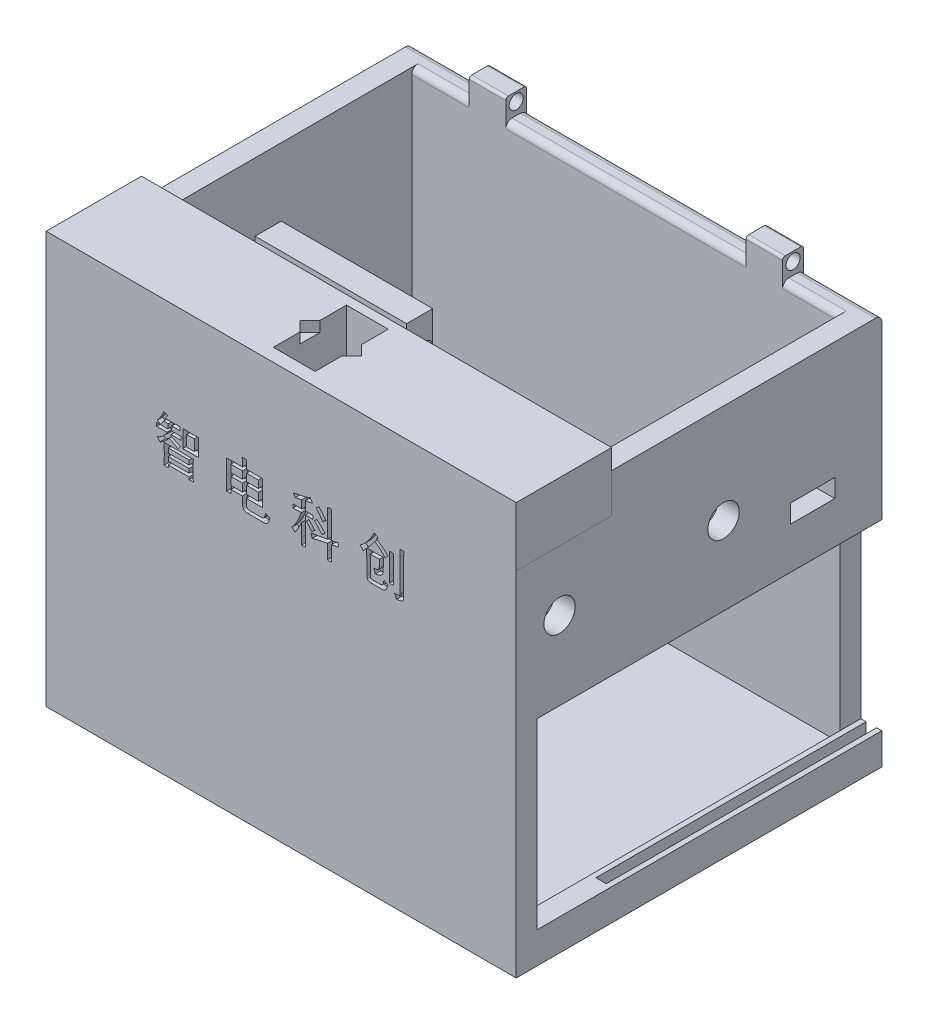
from build123d import *

# Parameters (mm, degrees)
SKETCH_1_W             = 90
SKETCH_1_H             = 70
EXTRUDE_1_DEPTH        = 75
SHELL_1_T              = -4
SKETCH_2_W             = 7
SKETCH_2_H             = 4
EXTRUDE_2_DEPTH        = 4
FILLET_3_R             = 0.5
SKETCH_4_R             = 1.35
CUT_EXTRUDE_1_DEPTH    = 126.558751188
FILLET_3_OF_MIRROR_2_R = 0.5
EXTRUDE_START          = -90
SKETCH_6_W             = 18.256446172
SKETCH_6_H             = 3.830399347
SKETCH_6_H_2           = 7.485933585
EXTRUDE_3_DEPTH        = 90.000012
SKETCH_7_W             = 66
SKETCH_7_H             = 35
CUT_EXTRUDE_2_DEPTH    = 4
SKETCH_8_W             = 8
SKETCH_8_H             = 14
CUT_EXTRUDE_3_DEPTH    = 17
SKETCH_10_W            = 5
SKETCH_10_H            = 12
EXTRUDE_4_DEPTH        = 29
SKETCH_13_R            = 1.25
CUT_EXTRUDE_5_DEPTH    = 10
SKETCH_14_W            = 30
SKETCH_14_H            = 4
EXTRUDE_5_DEPTH        = 25
CUT_EXTRUDE_6_DEPTH    = 2
FILLET_4_R             = 1.2
SKETCH_16_R            = 3
CUT_EXTRUDE_8_DEPTH    = 10
SKETCH_17_W            = 2
SKETCH_17_H            = 51.743553828
CUT_EXTRUDE_9_DEPTH    = 2
CUT_EXTRUDE_10_REACH   = 140.712
SKETCH_18_W            = 8.5
SKETCH_18_H            = 3.5
SKETCH_22_W            = 3.991228071
SKETCH_22_H            = 0.83625731
SKETCH_22_H_2          = 0.798245614
SKETCH_22_W_2          = 1.444444444
SKETCH_22_H_3          = 2.090643275
SKETCH_22_W_3          = 2.280701755
SKETCH_22_H_4          = 1.520467836
SKETCH_22_W_4          = 2.204678363
SKETCH_22_H_5          = 1.406432748
CUT_EXTRUDE_13_DEPTH   = 1


with BuildPart() as part:
    # 草图1 → 凸台-拉伸1 (new body)
    with BuildSketch(Plane(origin=(0, 0, 0), x_dir=(1, 0, 0), z_dir=(0, 1, 0))):
        with Locations((45, 35)):
            Rectangle(SKETCH_1_W, SKETCH_1_H)
    extrude(amount=EXTRUDE_1_DEPTH)

    # 抽壳1
    shell_1_openings = [part.faces().sort_by_distance(p)[0] for p in [
        (45, 75, -35),
    ]]
    offset(amount=SHELL_1_T, openings=shell_1_openings, kind=Kind.INTERSECTION)

    # 草图2 → 凸台-拉伸2 (add)
    with BuildSketch(Plane(origin=(0, 75, 0), x_dir=(1, 0, 0), z_dir=(0, 1, 0))):
        with Locations((18.5, 68)):
            Rectangle(SKETCH_2_W, SKETCH_2_H)
    extrude_2 = extrude(amount=EXTRUDE_2_DEPTH)

    # 圆角3
    fillet_3_edges = [part.edges().sort_by_distance(p)[0] for p in [
        (18.5, 79, -70),
        (18.5, 79, -66),
    ]]
    fillet(fillet_3_edges, radius=FILLET_3_R)

    # 草图4 → 切除-拉伸1 (cut, through all)
    with BuildSketch(Plane(origin=(22, 0, 0), x_dir=(0, 0, -1), z_dir=(1, 0, 0))):
        with Locations((68, 77.3)):
            Circle(SKETCH_4_R)
    cut_extrude_1 = extrude(amount=-CUT_EXTRUDE_1_DEPTH, mode=Mode.SUBTRACT)

    # 镜向2: 凸台-拉伸2, 切除-拉伸1 across plane
    add(extrude_2.mirror(Plane.ZY.offset(-45)))
    add(cut_extrude_1.mirror(Plane.ZY.offset(-45)), mode=Mode.SUBTRACT)

    # 圆角3 of 镜向2
    fillet_3_of_mirror_2_edges = [part.edges().sort_by_distance(p)[0] for p in [
        (71.5, 79, -70),
        (71.5, 79, -66),
    ]]
    fillet(fillet_3_of_mirror_2_edges, radius=FILLET_3_OF_MIRROR_2_R)

    # 草图6 → 凸台-拉伸3 (add)
    with BuildSketch(Plane(origin=(90, 0, 0), x_dir=(0, 0, -1), z_dir=(1, 0, 0)).offset(EXTRUDE_START)):
        with Locations((9.128223086, 76.915199674)):
            Rectangle(SKETCH_6_W, SKETCH_6_H)
        with Locations((9.128223086, 71.257033208)):
            Rectangle(SKETCH_6_W, SKETCH_6_H_2)
    extrude(amount=EXTRUDE_3_DEPTH)

    # 草图7 → 切除-拉伸2 (cut)
    with BuildSketch(Plane(origin=(90, 0, 0), x_dir=(0, 0, -1), z_dir=(1, 0, 0))):
        with Locations((37, 23.5)):
            Rectangle(SKETCH_7_W, SKETCH_7_H)
    extrude(amount=-CUT_EXTRUDE_2_DEPTH, mode=Mode.SUBTRACT)

    # 草图8 → 切除-拉伸3 (cut)
    with BuildSketch(Plane(origin=(0, 78.830399347, 0), x_dir=(1, 0, 0), z_dir=(0, 1, 0))):
        with Locations((45, 9.5)):
            Rectangle(SKETCH_8_W, SKETCH_8_H)
    extrude(amount=-CUT_EXTRUDE_3_DEPTH, mode=Mode.SUBTRACT)

    # 草图10 → 凸台-拉伸4 (add)
    with BuildSketch(Plane(origin=(4, 0, 0), x_dir=(0, 0, -1), z_dir=(1, 0, 0))):
        with Locations((38.5, 56)):
            Rectangle(SKETCH_10_W, SKETCH_10_H)
        with Locations((9.5, 56)):
            Rectangle(SKETCH_10_W, SKETCH_10_H)
    extrude(amount=EXTRUDE_4_DEPTH)

    # 草图13 → 切除-拉伸5 (cut)
    with BuildSketch(Plane(origin=(33, 0, 0), x_dir=(0, 0, -1), z_dir=(1, 0, 0))):
        with Locations((39.7, 56)):
            Circle(SKETCH_13_R)
        with Locations(Location((8.3, 56, 0), (0, 0, 180))):
            Circle(SKETCH_13_R)
    extrude(amount=-CUT_EXTRUDE_5_DEPTH, mode=Mode.SUBTRACT)

    # 草图14 → 凸台-拉伸5 (add)
    with BuildSketch(Plane(origin=(0, 0, -4), x_dir=(-1, 0, 0), z_dir=(0, 0, -1))):
        with Locations((-72, 44)):
            Rectangle(SKETCH_14_W, SKETCH_14_H)
    extrude(amount=EXTRUDE_5_DEPTH)

    # 草图15 → 切除-拉伸6 (cut)
    with BuildSketch(Plane(origin=(0, 78.830399347, 0), x_dir=(1, 0, 0), z_dir=(0, 1, 0))):
        Polygon((49, 11.413009546), (50.913009546, 9.5), (49, 7.586990454), align=None)
        Polygon((41, 7.586990454), (41, 11.413009546), (39.086990454, 9.5), align=None)
    extrude(amount=-CUT_EXTRUDE_6_DEPTH, mode=Mode.SUBTRACT)

    # 圆角4
    fillet_4_edges = [part.edges().sort_by_distance(p)[0] for p in [
        (9.5, 75, -66),
        (45, 75, -70),
        (45, 75, -66),
        (7.5, 75, -70),
        (80.5, 75, -66),
        (82.5, 75, -70),
    ]]
    fillet(fillet_4_edges, radius=FILLET_4_R)

    # 草图16 → 切除-拉伸8 (cut)
    with BuildSketch(Plane(origin=(90, 0, 0), x_dir=(0, 0, -1), z_dir=(1, 0, 0))):
        with Locations((8.3, 56)):
            Circle(SKETCH_16_R)
        with Locations((39.7, 56)):
            Circle(SKETCH_16_R)
    extrude(amount=-CUT_EXTRUDE_8_DEPTH, mode=Mode.SUBTRACT)

    # 草图17 → 切除-拉伸9 (cut)
    with BuildSketch(Plane(origin=(0, 6, 0), x_dir=(1, 0, 0), z_dir=(0, 1, 0))):
        with Locations((88, 44.128223086)):
            Rectangle(SKETCH_17_W, SKETCH_17_H)
    cut_extrude_9 = extrude(amount=-CUT_EXTRUDE_9_DEPTH, mode=Mode.SUBTRACT)

    # 镜向3: 切除-拉伸9 across plane
    add(cut_extrude_9.mirror(Plane.ZX.offset(23.5)), mode=Mode.SUBTRACT)

    # 草图18 → 切除-拉伸10 (cut, up to next)
    with BuildSketch(Plane(origin=(90, 0, 0), x_dir=(0, 0, -1), z_dir=(1, 0, 0)), mode=Mode.PRIVATE) as cut_extrude_10_sk1:
        with Locations((56.75, 50.75)):
            Rectangle(SKETCH_18_W, SKETCH_18_H)
    cut_extrude_10_tool1 = extrude(cut_extrude_10_sk1.sketch, amount=-CUT_EXTRUDE_10_REACH, mode=Mode.PRIVATE) & part.part
    add(cut_extrude_10_tool1.solids().sort_by_distance((90, 50.75, -56.75))[0], mode=Mode.SUBTRACT)

    # 草图22 → 切除-拉伸13 (cut)
    # profile 1 of 12: a face of its own
    with BuildSketch(Plane.XY):
        with BuildLine():
            add(Edge.make_bspline(
                [(28.165960381, 55.10846109), (28.163134734, 55.051679378), (28.157157268, 54.931561451), (28.147914895, 54.741557576), (28.143531593, 54.532180049), (28.137229462, 54.30413861), (28.133150208, 54.057284017), (28.130919089, 53.791191064), (28.127126936, 53.505877917), (28.127669165, 53.309242203), (28.127948685, 53.207876295)],
                knots=[0, 0, 0, 0, 0.717688836, 1.518222909, 2.401221988, 3.361207998, 4.398066271, 5.517771386, 6.720408654, 8, 8, 8, 8], degree=3))
            add(Edge.make_bspline(
                [(28.127948685, 53.207876295), (28.127667125, 53.106510371), (28.127122241, 52.91034389), (28.130924805, 52.625500129), (28.133162774, 52.359407363), (28.137214343, 52.112083004), (28.143506584, 51.884041171), (28.147940353, 51.675134172), (28.157199059, 51.48513179), (28.163139891, 51.364542753), (28.165960381, 51.3072915)],
                knots=[0, 0, 0, 0, 1.279592248, 2.476306615, 3.596012518, 4.638794695, 5.598781382, 6.475859193, 7.276393831, 8, 8, 8, 8], degree=3))
            Line((28.165960381, 51.3072915), (27.367714767, 51.3072915))
            Line((27.367714767, 51.3072915), (27.367714767, 51.76343185))
            Line((27.367714767, 51.76343185), (23.376486696, 51.76343185))
            Line((23.376486696, 51.76343185), (23.376486696, 51.3072915))
            Line((23.376486696, 51.3072915), (22.578241082, 51.3072915))
            add(Edge.make_bspline(
                [(22.578241082, 51.3072915), (22.581075708, 51.361257031), (22.587113746, 51.476209067), (22.596288468, 51.658706116), (22.600698109, 51.861515795), (22.606992837, 52.083925448), (22.611060583, 52.326557302), (22.61328319, 52.589365499), (22.617084046, 52.872801405), (22.616536429, 53.068498657), (22.616252778, 53.169864599)],
                knots=[0, 0, 0, 0, 0.696099489, 1.482762265, 2.353551712, 3.30893886, 4.348805569, 5.479251049, 6.694319468, 8, 8, 8, 8], degree=3))
            add(Edge.make_bspline(
                [(22.616252778, 53.169864599), (22.616533713, 53.274046162), (22.617077877, 53.475843791), (22.613278778, 53.768665605), (22.611056161, 54.041328251), (22.606985176, 54.293814302), (22.600679603, 54.526079609), (22.596311781, 54.73827281), (22.587038805, 54.930153232), (22.581065852, 55.051210055), (22.578241082, 55.10846109)],
                knots=[0, 0, 0, 0, 1.289361226, 2.497467228, 3.624266192, 4.664032279, 5.622622853, 6.499928456, 7.290575728, 8, 8, 8, 8], degree=3))
            Line((22.578241082, 55.10846109), (28.165960381, 55.10846109))
        make_face()
        with Locations((25.372100732, 54.158168693)):
            Rectangle(SKETCH_22_W, SKETCH_22_H, mode=Mode.SUBTRACT)
        with Locations((25.372100732, 52.770741792)):
            Rectangle(SKETCH_22_W, SKETCH_22_H_2, mode=Mode.SUBTRACT)
    # profile 2 of 12: a face of its own
    with BuildSketch(Plane.XY):
        with BuildLine():
            add(Edge.make_bspline(
                [(23.300463305, 59.897934774), (23.254831976, 59.850118115), (23.158577232, 59.749253635), (23.019231767, 59.579540428), (22.8730454, 59.387713941), (22.779302801, 59.248501945), (22.730287866, 59.175712552)],
                knots=[0, 0, 0, 0, 0.860429603, 1.814990543, 2.857530113, 4, 4, 4, 4], degree=3))
            add(Edge.make_bspline(
                [(22.730287866, 59.175712552), (22.895006108, 59.175423852), (23.210836306, 59.174870299), (23.665093933, 59.178653985), (24.07994451, 59.180892716), (24.455848741, 59.184888755), (24.792771826, 59.191218506), (25.090354894, 59.195518529), (25.348895226, 59.204660172), (25.507959406, 59.210867478), (25.581165059, 59.213724248)],
                knots=[0, 0, 0, 0, 1.386451186, 2.658376808, 3.823654584, 4.878372057, 5.822555073, 6.660104833, 7.383343872, 8, 8, 8, 8], degree=3))
            Line((25.581165059, 59.213724248), (25.581165059, 58.529513722))
            add(Edge.make_bspline(
                [(25.581165059, 58.529513722), (25.445088141, 58.53553894), (25.179091288, 58.547316757), (24.78952941, 58.557947074), (24.418787126, 58.56552429), (24.178020798, 58.566869774), (24.060697223, 58.567525418)],
                knots=[0, 0, 0, 0, 1.074576133, 2.100531618, 3.074403708, 4, 4, 4, 4], degree=3))
            add(Edge.make_bspline(
                [(24.060697223, 58.567525418), (24.060001671, 58.506513453), (24.05851925, 58.376479308), (24.050901939, 58.169982457), (24.040009861, 57.93949386), (24.028660133, 57.778175791), (24.022685527, 57.693256412)],
                knots=[0, 0, 0, 0, 0.8365234, 1.782873351, 2.832883257, 4, 4, 4, 4], degree=3))
            add(Edge.make_bspline(
                [(24.022685527, 57.693256412), (24.12076656, 57.692972033), (24.309894154, 57.692423671), (24.583474917, 57.696219466), (24.836897735, 57.698455523), (25.070614126, 57.702509044), (25.284106895, 57.708778727), (25.477535013, 57.713206961), (25.650176037, 57.722356298), (25.758555027, 57.728428584), (25.809235234, 57.731268108)],
                knots=[0, 0, 0, 0, 1.317082673, 2.539702846, 3.674102439, 4.720377199, 5.678587124, 6.542305879, 7.318352759, 8, 8, 8, 8], degree=3))
            Line((25.809235234, 57.731268108), (25.809235234, 57.047057581))
            add(Edge.make_bspline(
                [(25.809235234, 57.047057581), (25.757616581, 57.049899318), (25.646891967, 57.055994987), (25.468619947, 57.065227737), (25.266742763, 57.069525193), (25.041049261, 57.075865065), (24.791846038, 57.079879224), (24.518714486, 57.08212206), (24.221668724, 57.085903464), (24.015647673, 57.085354423), (23.908650439, 57.085069277)],
                knots=[0, 0, 0, 0, 0.652599893, 1.399859659, 2.253233241, 3.201356656, 4.250041164, 5.399342793, 6.649346148, 8, 8, 8, 8], degree=3))
            Line((23.908650439, 57.085069277), (23.832627047, 56.818987406))
            add(Edge.make_bspline(
                [(23.832627047, 56.818987406), (23.92838608, 56.781512634), (24.114951841, 56.708501146), (24.386707361, 56.600859114), (24.641899627, 56.494331147), (24.882354749, 56.39339585), (25.107943781, 56.296512568), (25.317786792, 56.202273307), (25.511911123, 56.110824908), (25.635678398, 56.049995615), (25.695200147, 56.020741792)],
                knots=[0, 0, 0, 0, 1.217478731, 2.371993931, 3.460560076, 4.491433558, 5.459547401, 6.367248122, 7.214782365, 8, 8, 8, 8], degree=3))
            add(Edge.make_bspline(
                [(25.695200147, 56.020741792), (25.647624214, 55.954231384), (25.557638958, 55.828433408), (25.433029828, 55.648505368), (25.328683326, 55.486752816), (25.267430695, 55.384084853), (25.239059796, 55.336531266)],
                knots=[0, 0, 0, 0, 1.192855985, 2.256171212, 3.192296089, 4, 4, 4, 4], degree=3))
            add(Edge.make_bspline(
                [(25.239059796, 55.336531266), (25.100183183, 55.434037609), (24.82717956, 55.625715563), (24.399095226, 55.870558986), (23.970161328, 56.084865452), (23.674627006, 56.194577334), (23.52853348, 56.248811967)],
                knots=[0, 0, 0, 0, 1.046220223, 2.056659537, 3.039335061, 4, 4, 4, 4], degree=3))
            add(Edge.make_bspline(
                [(23.52853348, 56.248811967), (23.473522814, 56.179590809), (23.362697174, 56.040136411), (23.179950022, 55.842466874), (22.98609026, 55.650545512), (22.777695653, 55.467106061), (22.55692012, 55.289987015), (22.323273273, 55.11947333), (22.076042438, 54.957355506), (21.904756938, 54.855801083), (21.818007164, 54.804367523)],
                knots=[0, 0, 0, 0, 0.941490525, 1.896746551, 2.865224293, 3.846121799, 4.852367462, 5.879161404, 6.925873659, 8, 8, 8, 8], degree=3))
            add(Edge.make_bspline(
                [(21.818007164, 54.804367523), (21.778351181, 54.854705796), (21.697789331, 54.956968911), (21.561394985, 55.101992295), (21.411370497, 55.242625193), (21.302846114, 55.330165868), (21.247831726, 55.374542962)],
                knots=[0, 0, 0, 0, 0.950670924, 1.931305206, 2.951314193, 4, 4, 4, 4], degree=3))
            add(Edge.make_bspline(
                [(21.247831726, 55.374542962), (21.354358107, 55.42193061), (21.568326191, 55.517113083), (21.873945796, 55.695133102), (22.168209404, 55.899997082), (22.399588085, 56.092589083), (22.575897781, 56.25342466), (22.693314819, 56.376963591), (22.801783686, 56.496093268), (22.895831183, 56.61590888), (22.978144202, 56.734121384), (23.047360874, 56.851934625), (23.106113563, 56.967495403), (23.134625338, 57.04673903), (23.148416521, 57.085069277)],
                knots=[0, 0, 0, 0, 1.601391474, 3.216542815, 4.851849856, 6.524081266, 7.350155524, 8.130127338, 8.865520099, 9.563565357, 10.221927471, 10.843567295, 11.440631977, 12, 12, 12, 12], degree=3))
            add(Edge.make_bspline(
                [(23.148416521, 57.085069277), (23.035318709, 57.085355094), (22.817566016, 57.08590539), (22.503156576, 57.08211027), (22.214069729, 57.079894246), (21.949851048, 57.075845262), (21.710546239, 57.069527518), (21.496003821, 57.065223737), (21.306465744, 57.055994708), (21.188700384, 57.049899327), (21.133796638, 57.047057581)],
                knots=[0, 0, 0, 0, 1.346904771, 2.593260969, 3.744611422, 4.789854585, 5.740216353, 6.59559745, 7.345249219, 8, 8, 8, 8], degree=3))
            Line((21.133796638, 57.047057581), (21.133796638, 57.731268108))
            add(Edge.make_bspline(
                [(21.133796638, 57.731268108), (21.189638408, 57.728414057), (21.310685028, 57.722227411), (21.507268614, 57.71306125), (21.733539883, 57.708754158), (21.9897407, 57.70243871), (22.275546414, 57.698438235), (22.590911732, 57.696194397), (22.935825357, 57.692418385), (23.175633607, 57.692969523), (23.300463305, 57.693256412)],
                knots=[0, 0, 0, 0, 0.619202912, 1.342228594, 2.179169066, 3.125212228, 4.180274652, 5.344400755, 6.617655352, 8, 8, 8, 8], degree=3))
            add(Edge.make_bspline(
                [(23.300463305, 57.693256412), (23.311672493, 57.772931238), (23.333438852, 57.927646359), (23.350490961, 58.15377001), (23.352597102, 58.365950917), (23.343075472, 58.501859711), (23.338475, 58.567525418)],
                knots=[0, 0, 0, 0, 1.100425231, 2.136840844, 3.099795842, 4, 4, 4, 4], degree=3))
            Line((23.338475, 58.567525418), (22.464205995, 58.567525418))
            add(Edge.make_bspline(
                [(22.464205995, 58.567525418), (22.425495043, 58.498120602), (22.348029276, 58.359232324), (22.218683914, 58.157891815), (22.081186365, 57.960168691), (21.981922406, 57.833121191), (21.932042252, 57.769279804)],
                knots=[0, 0, 0, 0, 0.992557335, 1.986239381, 2.988084993, 4, 4, 4, 4], degree=3))
            add(Edge.make_bspline(
                [(21.932042252, 57.769279804), (21.866204133, 57.805639739), (21.742021633, 57.874221099), (21.568712733, 57.974766611), (21.418080739, 58.063433859), (21.327431507, 58.122361788), (21.285843422, 58.149396763)],
                knots=[0, 0, 0, 0, 1.203506377, 2.270028857, 3.206323262, 4, 4, 4, 4], degree=3))
            add(Edge.make_bspline(
                [(21.285843422, 58.149396763), (21.339078108, 58.21220881), (21.453677692, 58.347425806), (21.622645241, 58.576656754), (21.804187483, 58.843027597), (21.95791039, 59.087686668), (22.083121884, 59.291666907), (22.16870957, 59.442803518), (22.24699082, 59.586495321), (22.314683019, 59.723746628), (22.377055542, 59.852307141), (22.426912698, 59.974992818), (22.47040246, 60.09000854), (22.49190993, 60.165735243), (22.502217691, 60.202028342)],
                knots=[0, 0, 0, 0, 1.235038088, 2.658696051, 4.269830463, 6.070755045, 6.993291449, 7.860485822, 8.676401911, 9.44784651, 10.156490949, 10.819413862, 11.434187314, 12, 12, 12, 12], degree=3))
            add(Edge.make_bspline(
                [(22.502217691, 60.202028342), (22.556379243, 60.176063779), (22.67169443, 60.120782714), (22.860419754, 60.046590537), (23.071972152, 59.969966225), (23.221898884, 59.922702075), (23.300463305, 59.897934774)],
                knots=[0, 0, 0, 0, 0.842680993, 1.79414938, 2.844092885, 4, 4, 4, 4], degree=3))
        make_face()
    # profile 3 of 12: a face of its own
    with BuildSketch(Plane.XY):
        with BuildLine():
            add(Edge.make_bspline(
                [(26.151340498, 55.868695008), (26.154144021, 55.921723551), (26.159973751, 56.031992713), (26.169296087, 56.203681982), (26.173731988, 56.38819461), (26.180047382, 56.585728294), (26.184121888, 56.796449864), (26.186356945, 57.020309532), (26.190171331, 57.257284601), (26.189630444, 57.419664385), (26.189352193, 57.503197932)],
                knots=[0, 0, 0, 0, 0.779414185, 1.620737502, 2.523455647, 3.488136681, 4.521508502, 5.616750258, 6.773977286, 8, 8, 8, 8], degree=3))
            add(Edge.make_bspline(
                [(26.189352193, 57.503197932), (26.189628874, 57.589547086), (26.190167215, 57.757557899), (26.186377494, 58.002042148), (26.184112152, 58.232470935), (26.18006898, 58.448355064), (26.173714494, 58.65058107), (26.169354685, 58.838380284), (26.160013545, 59.011947647), (26.154148893, 59.122684287), (26.151340498, 59.175712552)],
                knots=[0, 0, 0, 0, 1.238563026, 2.409890213, 3.507178093, 4.543998171, 5.506953548, 6.409352315, 7.238289259, 8, 8, 8, 8], degree=3))
            Line((26.151340498, 59.175712552), (29.154264474, 59.175712552))
            add(Edge.make_bspline(
                [(29.154264474, 59.175712552), (29.151416468, 59.13394969), (29.145274344, 59.043882236), (29.136060895, 58.898000087), (29.131764037, 58.730830243), (29.125420605, 58.541746578), (29.121456713, 58.331489268), (29.119180015, 58.099653093), (29.115418836, 57.846720842), (29.115967488, 57.670732533), (29.116252778, 57.579221324)],
                knots=[0, 0, 0, 0, 0.628982284, 1.356488263, 2.196056314, 3.141339513, 4.199232735, 5.355717388, 6.625013781, 8, 8, 8, 8], degree=3))
            add(Edge.make_bspline(
                [(29.116252778, 57.579221324), (29.115973004, 57.487240879), (29.115430568, 57.308906344), (29.119218938, 57.050343036), (29.12145601, 56.809590226), (29.125504952, 56.58713579), (29.131833589, 56.382562409), (29.136198541, 56.195699776), (29.145484328, 56.026353028), (29.15144199, 55.919376092), (29.154264474, 55.868695008)],
                knots=[0, 0, 0, 0, 1.290022382, 2.501135341, 3.626691029, 4.666794469, 5.621510824, 6.49727896, 7.288075228, 8, 8, 8, 8], degree=3))
            Line((29.154264474, 55.868695008), (26.151340498, 55.868695008))
        make_face()
        with Locations((27.633796638, 57.522203781)):
            Rectangle(SKETCH_22_W_2, SKETCH_22_H_3, mode=Mode.SUBTRACT)
    # profile 4 of 12: a face of its own
    with BuildSketch(Plane.XY):
        with BuildLine():
            add(Edge.make_bspline(
                [(42.861282018, 52.713724248), (42.839492579, 52.644187031), (42.7976904, 52.510782621), (42.733692675, 52.321309643), (42.669634672, 52.151639065), (42.609394847, 52.000829951), (42.546148277, 51.871265587), (42.48850167, 51.758926921), (42.429344753, 51.667216428), (42.370639796, 51.591815285), (42.305638323, 51.532306362), (42.234615782, 51.480271583), (42.152491834, 51.438840455), (42.061229048, 51.40493937), (41.961181622, 51.378718118), (41.851615685, 51.358553633), (41.732400748, 51.34799421), (41.649618373, 51.346219228), (41.606896053, 51.345303195)],
                knots=[0, 0, 0, 0, 1.702174165, 3.265554056, 4.67040763, 5.938607077, 7.056486703, 8.037238336, 8.885550175, 9.602851616, 10.262105392, 10.937474938, 11.653267151, 12.40252239, 13.20818955, 14.06607918, 15.001942329, 16, 16, 16, 16], degree=3))
            Line((41.606896053, 51.345303195), (38.641983772, 51.345303195))
            add(Edge.make_bspline(
                [(38.641983772, 51.345303195), (38.60068797, 51.34485065), (38.520372107, 51.343970498), (38.403008339, 51.350187846), (38.293339271, 51.367412887), (38.191016234, 51.391866716), (38.097698772, 51.428062059), (38.011101159, 51.470201352), (37.931214342, 51.52006869), (37.862597893, 51.582768586), (37.797603077, 51.649719927), (37.743324909, 51.728450628), (37.6949533, 51.814389687), (37.655591834, 51.909450867), (37.625008124, 52.012947522), (37.601193342, 52.124970343), (37.583997152, 52.245378547), (37.579804172, 52.328856685), (37.577656287, 52.371618985)],
                knots=[0, 0, 0, 0, 1.168119821, 2.271866497, 3.319426777, 4.304575247, 5.241409998, 6.143755183, 7.027454658, 7.892819379, 8.76618987, 9.661182454, 10.588185367, 11.552088977, 12.564145767, 13.636803855, 14.789435116, 16, 16, 16, 16], degree=3))
            Line((37.577656287, 52.371618985), (37.577656287, 53.702028342))
            Line((37.577656287, 53.702028342), (35.372977924, 53.702028342))
            Line((35.372977924, 53.702028342), (35.372977924, 52.979806119))
            Line((35.372977924, 52.979806119), (34.498708919, 52.979806119))
            add(Edge.make_bspline(
                [(34.498708919, 52.979806119), (34.500173737, 52.998103957), (34.503476984, 53.039366588), (34.507568705, 53.10883679), (34.511624061, 53.192846755), (34.516238708, 53.291371082), (34.518458891, 53.404505373), (34.521396969, 53.531675583), (34.524227081, 53.673868555), (34.526878517, 53.830141059), (34.530183544, 54.001417449), (34.531014122, 54.18726527), (34.532571481, 54.38764597), (34.533967275, 54.602576792), (34.535262747, 54.831585751), (34.5371467, 55.075608913), (34.536604436, 55.334185194), (34.536681211, 55.51157289), (34.536720614, 55.602613137)],
                knots=[0, 0, 0, 0, 0.335849478, 0.75735909, 1.273172232, 1.874755125, 2.561862521, 3.343391738, 4.202179413, 5.163982611, 6.203049845, 7.336455448, 8.564306306, 9.869430823, 11.269001192, 12.754431635, 14.334285019, 16, 16, 16, 16], degree=3))
            add(Edge.make_bspline(
                [(34.536720614, 55.602613137), (34.536682164, 55.694122668), (34.536607037, 55.872918215), (34.537141948, 56.134779375), (34.535251853, 56.384433905), (34.533950829, 56.622359147), (34.532575542, 56.848083472), (34.531001537, 57.061604138), (34.530157707, 57.26246751), (34.526859523, 57.451577501), (34.524165225, 57.62849738), (34.521383372, 57.793216139), (34.518392459, 57.945727652), (34.516172812, 58.086071263), (34.511520749, 58.214163187), (34.507372454, 58.330077561), (34.503238001, 58.433793958), (34.500152136, 58.499012091), (34.498708919, 58.529513722)],
                knots=[0, 0, 0, 0, 1.500478727, 2.931704589, 4.293699324, 5.594136985, 6.833017677, 7.994952324, 9.095330294, 10.126543337, 11.096205569, 11.996624329, 12.827801185, 13.597431334, 14.298035147, 14.929427821, 15.499307993, 16, 16, 16, 16], degree=3))
            Line((34.498708919, 58.529513722), (37.577656287, 58.529513722))
            add(Edge.make_bspline(
                [(37.577656287, 58.529513722), (37.577934572, 58.612577999), (37.578475437, 58.774019276), (37.574670163, 59.009117247), (37.572440764, 59.230161595), (37.568347941, 59.43712897), (37.5620952, 59.629501634), (37.557589382, 59.807914718), (37.548395787, 59.971630598), (37.542464412, 60.076262254), (37.539644591, 60.12600495)],
                knots=[0, 0, 0, 0, 1.248126266, 2.425821371, 3.533006246, 4.56980153, 5.536277045, 6.425221315, 7.251338075, 8, 8, 8, 8], degree=3))
            Line((37.539644591, 60.12600495), (38.375901901, 60.12600495))
            add(Edge.make_bspline(
                [(38.375901901, 60.12600495), (38.373057589, 60.081895278), (38.36694695, 59.987131344), (38.357785861, 59.835145061), (38.353433139, 59.663758877), (38.347126559, 59.473735114), (38.343076091, 59.264888279), (38.340841516, 59.036805273), (38.337061257, 58.789505002), (38.337607411, 58.618209289), (38.337890205, 58.529513722)],
                knots=[0, 0, 0, 0, 0.664174484, 1.426893108, 2.28761838, 3.239966529, 4.283778659, 5.42618217, 6.667297463, 8, 8, 8, 8], degree=3))
            Line((38.337890205, 58.529513722), (41.416837574, 58.529513722))
            add(Edge.make_bspline(
                [(41.416837574, 58.529513722), (41.413955492, 58.475550464), (41.407541332, 58.355453633), (41.398533783, 58.156042043), (41.394265349, 57.918508929), (41.387947701, 57.642596539), (41.383999914, 57.329102975), (41.381732955, 56.97760432), (41.377980672, 56.588107943), (41.378535549, 56.315450788), (41.378825878, 56.172788576)],
                knots=[0, 0, 0, 0, 0.550195381, 1.224476137, 2.032152029, 2.968797626, 4.034345488, 5.224058355, 6.547546001, 8, 8, 8, 8], degree=3))
            add(Edge.make_bspline(
                [(41.378825878, 56.172788576), (41.378539503, 56.032472761), (41.377988775, 55.762631255), (41.381775649, 55.373604577), (41.384009923, 55.016474271), (41.388023587, 54.691251145), (41.394328679, 54.398442843), (41.398682714, 54.137926278), (41.407844339, 53.909426322), (41.413988795, 53.767725598), (41.416837574, 53.702028342)],
                knots=[0, 0, 0, 0, 1.362686635, 2.620584247, 3.77822015, 4.831086897, 5.779218089, 6.622549017, 7.361367053, 8, 8, 8, 8], degree=3))
            Line((41.416837574, 53.702028342), (38.337890205, 53.702028342))
            Line((38.337890205, 53.702028342), (38.337890205, 52.675712552))
            add(Edge.make_bspline(
                [(38.337890205, 52.675712552), (38.33978409, 52.62201657), (38.343366152, 52.520456906), (38.376950909, 52.378637474), (38.433682875, 52.257736339), (38.515327348, 52.159069473), (38.619462468, 52.080737464), (38.747809417, 52.028082333), (38.897260857, 51.997635341), (39.003642888, 51.993628781), (39.060112427, 51.991502026)],
                knots=[0, 0, 0, 0, 1.129091727, 2.135544834, 3.045847686, 3.916186791, 4.805388208, 5.761506281, 6.811766361, 8, 8, 8, 8], degree=3))
            Line((39.060112427, 51.991502026), (41.07473231, 51.991502026))
            add(Edge.make_bspline(
                [(41.07473231, 51.991502026), (41.123096332, 51.992210661), (41.21438, 51.993548159), (41.343899327, 52.006089758), (41.457353511, 52.0268981), (41.556891575, 52.054036512), (41.639949866, 52.092396333), (41.710225297, 52.136596934), (41.762044414, 52.193359999), (41.813333541, 52.283028949), (41.856585903, 52.420544862), (41.905986532, 52.610856666), (41.950185632, 52.839547108), (41.974152485, 53.005038906), (41.987013012, 53.093841207)],
                knots=[0, 0, 0, 0, 1.042518898, 1.967680623, 2.801111341, 3.527935752, 4.184388731, 4.768041076, 5.305018465, 5.822088252, 6.9838114, 8.39479634, 10.06546074, 12, 12, 12, 12], degree=3))
            add(Edge.make_bspline(
                [(41.987013012, 53.093841207), (42.051845593, 53.051051521), (42.182255711, 52.964980477), (42.396132407, 52.861861374), (42.622399522, 52.77468421), (42.781016054, 52.734207164), (42.861282018, 52.713724248)],
                knots=[0, 0, 0, 0, 0.971041445, 1.953240594, 2.964262336, 4, 4, 4, 4], degree=3))
        make_face()
        with Locations((39.478241083, 55.10846109)):
            Rectangle(SKETCH_22_W_3, SKETCH_22_H_4, mode=Mode.SUBTRACT)
        with Locations((36.475317106, 55.10846109)):
            Rectangle(SKETCH_22_W_4, SKETCH_22_H_4, mode=Mode.SUBTRACT)
        with Locations((39.478241083, 57.180098517)):
            Rectangle(SKETCH_22_W_3, SKETCH_22_H_5, mode=Mode.SUBTRACT)
        with Locations((36.475317106, 57.180098517)):
            Rectangle(SKETCH_22_W_4, SKETCH_22_H_5, mode=Mode.SUBTRACT)
    # profile 5 of 12: a face of its own
    with BuildSketch(Plane.XY):
        with BuildLine():
            add(Edge.make_bspline(
                [(51.056603655, 56.552905535), (51.031738542, 56.555768561), (50.977371488, 56.562028508), (50.887832751, 56.571203588), (50.782537581, 56.575443732), (50.661988073, 56.581734457), (50.525867222, 56.585773293), (50.374739213, 56.587970966), (50.207690957, 56.591771517), (50.091296776, 56.59121102), (50.030287866, 56.590917231)],
                knots=[0, 0, 0, 0, 0.584607637, 1.278232431, 2.10142492, 3.045031703, 4.097736341, 5.281654166, 6.575158023, 8, 8, 8, 8], degree=3))
            Line((50.030287866, 56.590917231), (49.650170907, 56.590917231))
            Line((49.650170907, 56.590917231), (49.650170907, 52.523665769))
            add(Edge.make_bspline(
                [(49.650170907, 52.523665769), (49.65087008, 52.434968051), (49.652368477, 52.244880034), (49.660044473, 51.940779619), (49.670849169, 51.598623992), (49.682204731, 51.357960045), (49.688182603, 51.231268108)],
                knots=[0, 0, 0, 0, 0.823157098, 1.764107397, 2.82296634, 4, 4, 4, 4], degree=3))
            Line((49.688182603, 51.231268108), (48.889936989, 51.231268108))
            add(Edge.make_bspline(
                [(48.889936989, 51.231268108), (48.89591486, 51.357960045), (48.907270422, 51.598623992), (48.918075118, 51.940779619), (48.925751115, 52.244880034), (48.927249512, 52.434968051), (48.927948685, 52.523665769)],
                knots=[0, 0, 0, 0, 1.17703366, 2.235892603, 3.176842902, 4, 4, 4, 4], degree=3))
            Line((48.927948685, 52.523665769), (48.927948685, 55.032437698))
            add(Edge.make_bspline(
                [(48.927948685, 55.032437698), (48.884343239, 54.933188718), (48.79876936, 54.73841671), (48.664583521, 54.456478325), (48.53221357, 54.187543464), (48.395137695, 53.925549765), (48.243181701, 53.656900543), (48.067282692, 53.366671465), (47.862221726, 53.048959917), (47.713413477, 52.828879278), (47.635551024, 52.713724248)],
                knots=[0, 0, 0, 0, 0.978262199, 1.919799007, 2.817551823, 3.683266879, 4.587836443, 5.602493545, 6.745528323, 8, 8, 8, 8], degree=3))
            add(Edge.make_bspline(
                [(47.635551024, 52.713724248), (47.544360001, 52.815827067), (47.359198466, 53.023144785), (47.164291804, 53.221330849), (47.065375585, 53.321911383)],
                knots=[0, 0, 0, 0, 0.984988836, 2, 2, 2, 2], degree=3))
            add(Edge.make_bspline(
                [(47.065375585, 53.321911383), (47.17468677, 53.453156734), (47.387755061, 53.708978887), (47.676588735, 54.101548845), (47.931847908, 54.48820774), (48.150836012, 54.877743593), (48.348364003, 55.275440147), (48.528472443, 55.692567547), (48.70036773, 56.131984535), (48.800773231, 56.436023255), (48.851925293, 56.590917231)],
                knots=[0, 0, 0, 0, 1.091979114, 2.128475002, 3.11473886, 4.052685782, 4.984023631, 5.952933975, 6.957112451, 8, 8, 8, 8], degree=3))
            Line((48.851925293, 56.590917231), (48.585843422, 56.590917231))
            add(Edge.make_bspline(
                [(48.585843422, 56.590917231), (48.361011907, 56.589242135), (47.917272795, 56.58593608), (47.474074744, 56.563817288), (47.255434065, 56.552905535)],
                knots=[0, 0, 0, 0, 1.013349999, 2, 2, 2, 2], degree=3))
            Line((47.255434065, 56.552905535), (47.255434065, 57.275127757))
            add(Edge.make_bspline(
                [(47.255434065, 57.275127757), (47.474074744, 57.264216004), (47.917272795, 57.242097212), (48.361011907, 57.238791157), (48.585843422, 57.237116061)],
                knots=[0, 0, 0, 0, 0.986650001, 2, 2, 2, 2], degree=3))
            Line((48.585843422, 57.237116061), (48.927948685, 57.237116061))
            Line((48.927948685, 57.237116061), (48.927948685, 58.757583897))
            add(Edge.make_bspline(
                [(48.927948685, 58.757583897), (48.888052279, 58.750589218), (48.804911053, 58.736012811), (48.674786629, 58.712263162), (48.534210655, 58.683494498), (48.382398737, 58.653173164), (48.220093489, 58.617602414), (48.04752739, 58.578075312), (47.864066872, 58.535716169), (47.738320438, 58.506531656), (47.67356272, 58.491502026)],
                knots=[0, 0, 0, 0, 0.757982529, 1.579580812, 2.475147082, 3.443053681, 4.476542888, 5.584331995, 6.755963551, 8, 8, 8, 8], degree=3))
            add(Edge.make_bspline(
                [(47.67356272, 58.491502026), (47.647550678, 58.548184824), (47.595598175, 58.661394439), (47.504260831, 58.824904829), (47.40475962, 58.984652086), (47.330678675, 59.086508203), (47.293445761, 59.137700856)],
                knots=[0, 0, 0, 0, 0.995807029, 1.988873778, 2.989212536, 4, 4, 4, 4], degree=3))
            add(Edge.make_bspline(
                [(47.293445761, 59.137700856), (47.324437898, 59.141306418), (47.391689223, 59.1491303), (47.500488682, 59.165252126), (47.625095158, 59.184055523), (47.764385289, 59.211206616), (47.919797948, 59.236282192), (48.08988972, 59.269669514), (48.275760418, 59.30607589), (48.472416847, 59.345859279), (48.670670259, 59.38789785), (48.862557152, 59.42626437), (49.041959577, 59.466315505), (49.209466388, 59.503020825), (49.365200475, 59.535978551), (49.508363873, 59.570738603), (49.640525794, 59.600947808), (49.798680677, 59.63999889), (49.982666974, 59.690293396), (50.189284544, 59.762428094), (50.382761603, 59.841989432), (50.503282651, 59.905007966), (50.562451609, 59.93594647)],
                knots=[0, 0, 0, 0, 0.554304368, 1.202811644, 1.953975944, 2.792923246, 3.723631604, 4.750535866, 5.872235178, 7.088771267, 8.315152941, 9.472838673, 10.565277227, 11.580848047, 12.519551211, 13.39320293, 14.198108851, 14.928106689, 16.287532459, 17.584814962, 18.81428195, 20, 20, 20, 20], degree=3))
            add(Edge.make_bspline(
                [(50.562451609, 59.93594647), (50.59508006, 59.873145823), (50.660518762, 59.747194617), (50.771437979, 59.564827653), (50.888600925, 59.385135055), (50.975191925, 59.270953079), (51.01859196, 59.213724248)],
                knots=[0, 0, 0, 0, 0.992462499, 1.990454807, 2.992801444, 4, 4, 4, 4], degree=3))
            add(Edge.make_bspline(
                [(51.01859196, 59.213724248), (50.902754564, 59.19845872), (50.665598677, 59.167205343), (50.318278607, 59.08099789), (49.980245183, 58.996404301), (49.756555411, 58.963358576), (49.650170907, 58.947642377)],
                knots=[0, 0, 0, 0, 1.004276121, 2.056071735, 3.075488147, 4, 4, 4, 4], degree=3))
            Line((49.650170907, 58.947642377), (49.650170907, 57.237116061))
            Line((49.650170907, 57.237116061), (50.068299562, 57.237116061))
            add(Edge.make_bspline(
                [(50.068299562, 57.237116061), (50.126023567, 57.236828145), (50.236786874, 57.236275679), (50.395856963, 57.240050515), (50.54088456, 57.242288998), (50.671843705, 57.246302617), (50.788173918, 57.252524709), (50.890635623, 57.257029756), (50.978321867, 57.265896315), (51.032209199, 57.272251021), (51.056603655, 57.275127757)],
                knots=[0, 0, 0, 0, 1.399868989, 2.686128911, 3.858597896, 4.917585978, 5.863309352, 6.684008444, 7.4042589, 8, 8, 8, 8], degree=3))
            Line((51.056603655, 57.275127757), (51.056603655, 56.552905535))
        make_face()
    # profile 6 of 12: a face of its own
    with BuildSketch(Plane.XY):
        with BuildLine():
            add(Edge.make_bspline(
                [(53.869469153, 58.947642377), (53.869753965, 59.008651148), (53.870301718, 59.125983528), (53.86654995, 59.294440654), (53.864254263, 59.448851037), (53.860318371, 59.588727157), (53.853917801, 59.714906874), (53.849666324, 59.826755288), (53.840498065, 59.924275489), (53.834311291, 59.98428752), (53.831457457, 60.011969862)],
                knots=[0, 0, 0, 0, 1.374144617, 2.642761962, 3.795123306, 4.852633186, 5.794343395, 6.641027226, 7.373133195, 8, 8, 8, 8], degree=3))
            Line((53.831457457, 60.011969862), (54.667714767, 60.011969862))
            add(Edge.make_bspline(
                [(54.667714767, 60.011969862), (54.664857224, 59.988042948), (54.658644242, 59.936020094), (54.649546381, 59.851646885), (54.645278306, 59.755262867), (54.638829253, 59.646926833), (54.634937954, 59.527223149), (54.632624175, 59.395335932), (54.628866874, 59.25175323), (54.629416613, 59.151782032), (54.629703071, 59.09968916)],
                knots=[0, 0, 0, 0, 0.633028824, 1.376356593, 2.22836924, 3.166541736, 4.227335485, 5.374040659, 6.631668266, 8, 8, 8, 8], degree=3))
            Line((54.629703071, 59.09968916), (54.629703071, 54.842379219))
            add(Edge.make_bspline(
                [(54.629703071, 54.842379219), (54.708084748, 54.857332934), (54.85788477, 54.885911894), (55.07105401, 54.927602999), (55.261823893, 54.967682713), (55.429878439, 55.002605892), (55.575592972, 55.033021736), (55.698239446, 55.062037896), (55.799146093, 55.084572811), (55.858330721, 55.101217147), (55.884089036, 55.10846109)],
                knots=[0, 0, 0, 0, 1.493198783, 2.853743618, 4.064483043, 5.140894445, 6.065796098, 6.849718296, 7.499374774, 8, 8, 8, 8], degree=3))
            Line((55.884089036, 55.10846109), (55.998124123, 54.424250564))
            add(Edge.make_bspline(
                [(55.998124123, 54.424250564), (55.898068381, 54.409853487), (55.68848939, 54.379697049), (55.3604317, 54.31934545), (55.004383706, 54.24461683), (54.757718468, 54.187705027), (54.629703071, 54.158168693)],
                knots=[0, 0, 0, 0, 0.86975111, 1.821800081, 2.869548332, 4, 4, 4, 4], degree=3))
            Line((54.629703071, 54.158168693), (54.629703071, 52.713724248))
            add(Edge.make_bspline(
                [(54.629703071, 52.713724248), (54.631386763, 52.463556602), (54.634714156, 51.969163564), (54.656803061, 51.475254447), (54.667714767, 51.231268108)],
                knots=[0, 0, 0, 0, 1.012019295, 2, 2, 2, 2], degree=3))
            Line((54.667714767, 51.231268108), (53.831457457, 51.231268108))
            add(Edge.make_bspline(
                [(53.831457457, 51.231268108), (53.842369162, 51.475254447), (53.864458067, 51.969163564), (53.86778546, 52.463556602), (53.869469153, 52.713724248)],
                knots=[0, 0, 0, 0, 0.987980705, 2, 2, 2, 2], degree=3))
            Line((53.869469153, 52.713724248), (53.869469153, 54.006121909))
            add(Edge.make_bspline(
                [(53.869469153, 54.006121909), (53.728173143, 53.981488688), (53.453853128, 53.933664367), (53.05601461, 53.860263654), (52.683905111, 53.789682328), (52.33200127, 53.721811438), (51.989595498, 53.65014277), (51.646895452, 53.564153346), (51.296232818, 53.469565087), (51.061546939, 53.396808422), (50.942568568, 53.359923078)],
                knots=[0, 0, 0, 0, 1.147416584, 2.227659051, 3.236403145, 4.177368, 5.094837442, 6.034520741, 7.003563739, 8, 8, 8, 8], degree=3))
            Line((50.942568568, 53.359923078), (50.676486696, 54.120156997))
            add(Edge.make_bspline(
                [(50.676486696, 54.120156997), (50.776454051, 54.136988633), (50.985823524, 54.172240451), (51.313810337, 54.228789348), (51.67018078, 54.290155883), (52.054603811, 54.360382704), (52.468413663, 54.432430841), (52.910439879, 54.512911275), (53.380357619, 54.60088816), (53.703321805, 54.659948917), (53.869469153, 54.690332435)],
                knots=[0, 0, 0, 0, 0.75010222, 1.570997929, 2.46269174, 3.425794622, 4.462513795, 5.570653899, 6.750234768, 8, 8, 8, 8], degree=3))
            Line((53.869469153, 54.690332435), (53.869469153, 58.947642377))
        make_face()
    # profile 7 of 12: a face of its own
    with BuildSketch(Plane.XY):
        with BuildLine():
            add(Edge.make_bspline(
                [(51.816837574, 56.97103419), (51.940040148, 56.860040394), (52.180045177, 56.643818702), (52.484855485, 56.375512797), (52.732575881, 56.147763449), (52.939419725, 55.946183399), (53.168797674, 55.709961729), (53.328623381, 55.540420739), (53.413328802, 55.450566353)],
                knots=[0, 0, 0, 0, 1.353128953, 2.635965643, 3.313437088, 4.098750716, 4.99236411, 6, 6, 6, 6], degree=3))
            add(Edge.make_bspline(
                [(53.413328802, 55.450566353), (53.304446014, 55.363489215), (53.093852589, 55.195070742), (52.899168532, 55.008507401), (52.805141667, 54.918402611)],
                knots=[0, 0, 0, 0, 1.034056852, 2, 2, 2, 2], degree=3))
            add(Edge.make_bspline(
                [(52.805141667, 54.918402611), (52.690996948, 55.061216399), (52.465173991, 55.343758005), (52.10707469, 55.744434563), (51.74299899, 56.124947359), (51.487249648, 56.360382027), (51.360697223, 56.476882143)],
                knots=[0, 0, 0, 0, 1.031016956, 2.039755326, 3.030012299, 4, 4, 4, 4], degree=3))
            add(Edge.make_bspline(
                [(51.360697223, 56.476882143), (51.437450713, 56.555516059), (51.594089023, 56.715991936), (51.741605068, 56.884894604), (51.816837574, 56.97103419)],
                knots=[0, 0, 0, 0, 0.980009181, 2, 2, 2, 2], degree=3))
        make_face()
    # profile 8 of 12: a face of its own
    with BuildSketch(Plane.XY):
        with BuildLine():
            add(Edge.make_bspline(
                [(52.196954533, 59.251735944), (52.226075936, 59.221727934), (52.293107886, 59.152655184), (52.405935319, 59.034972741), (52.540171217, 58.88632029), (52.668406063, 58.745596603), (52.782917575, 58.616129324), (52.880227628, 58.505846404), (52.982185507, 58.382337908), (53.093766118, 58.251088137), (53.211050509, 58.107527591), (53.335786145, 57.953900945), (53.466509625, 57.788267119), (53.556860851, 57.675369654), (53.603387281, 57.61723302)],
                knots=[0, 0, 0, 0, 0.697777734, 1.606152047, 2.720248619, 4.039781281, 4.783090042, 5.604467303, 6.493807745, 7.455341031, 8.47905325, 9.587078707, 10.757464386, 12, 12, 12, 12], degree=3))
            add(Edge.make_bspline(
                [(53.603387281, 57.61723302), (53.542094164, 57.579672773), (53.422865587, 57.506609842), (53.254031905, 57.392785319), (53.099601502, 57.278446369), (53.003800821, 57.199503012), (52.957188451, 57.161092669)],
                knots=[0, 0, 0, 0, 1.089324225, 2.118974883, 3.084776462, 4, 4, 4, 4], degree=3))
            add(Edge.make_bspline(
                [(52.957188451, 57.161092669), (52.916827597, 57.219280879), (52.838626036, 57.332024005), (52.72521136, 57.495640213), (52.61627557, 57.646385219), (52.514109798, 57.785763726), (52.416588531, 57.912682962), (52.32552884, 58.027661952), (52.240850343, 58.131158485), (52.137890145, 58.250238379), (52.017541639, 58.383548547), (51.887579163, 58.533701333), (51.771588987, 58.669660016), (51.699029547, 58.755221526), (51.66479079, 58.795595593)],
                knots=[0, 0, 0, 0, 1.222303507, 2.368285951, 3.436057554, 4.432375457, 5.350953032, 6.198503754, 6.963888639, 7.65882795, 8.915353729, 10.063652477, 11.08629213, 12, 12, 12, 12], degree=3))
            add(Edge.make_bspline(
                [(51.66479079, 58.795595593), (51.714658024, 58.828089168), (51.813802365, 58.892691788), (51.951184917, 59.003638837), (52.080886506, 59.121478669), (52.15826519, 59.208316852), (52.196954533, 59.251735944)],
                knots=[0, 0, 0, 0, 1.01464541, 2.017283511, 3.008641756, 4, 4, 4, 4], degree=3))
        make_face()
    # profile 9 of 12: a face of its own
    with BuildSketch(Plane.XY):
        with BuildLine():
            add(Edge.make_bspline(
                [(50.296369737, 56.172788576), (50.330503254, 56.13326123), (50.402207621, 56.050226033), (50.517939134, 55.921456676), (50.649081384, 55.784070719), (50.793308237, 55.637317913), (50.948377999, 55.482619212), (51.107180998, 55.316167892), (51.270626083, 55.139853029), (51.380530385, 55.018472122), (51.436720614, 54.956414307)],
                knots=[0, 0, 0, 0, 0.751597531, 1.57888289, 2.491323206, 3.48468111, 4.5400859, 5.643493655, 6.795200657, 8, 8, 8, 8], degree=3))
            add(Edge.make_bspline(
                [(51.436720614, 54.956414307), (51.390277453, 54.9222588), (51.292310229, 54.850211162), (51.146887468, 54.724151674), (50.988504129, 54.583144679), (50.883406169, 54.478753983), (50.82853348, 54.424250564)],
                knots=[0, 0, 0, 0, 0.854830729, 1.803180274, 2.853018605, 4, 4, 4, 4], degree=3))
            add(Edge.make_bspline(
                [(50.82853348, 54.424250564), (50.760873578, 54.527486193), (50.621465027, 54.74019607), (50.379710054, 55.050881666), (50.106247485, 55.367213059), (49.905650493, 55.572688352), (49.802217691, 55.678636529)],
                knots=[0, 0, 0, 0, 0.911744227, 1.878585947, 2.9061461, 4, 4, 4, 4], degree=3))
            add(Edge.make_bspline(
                [(49.802217691, 55.678636529), (49.846855693, 55.706402896), (49.93928601, 55.763897721), (50.063264735, 55.880025605), (50.185902445, 56.015403771), (50.258528963, 56.118876122), (50.296369737, 56.172788576)],
                knots=[0, 0, 0, 0, 0.893217387, 1.849553312, 2.879547465, 4, 4, 4, 4], degree=3))
        make_face()
    # profile 10 of 12: a face of its own
    with BuildSketch(Plane.XY):
        with BuildLine():
            add(Edge.make_bspline(
                [(63.015083188, 53.511969862), (62.97378642, 53.652367919), (62.889925492, 53.937472829), (62.771232846, 54.209936474), (62.71098962, 54.348227172)],
                knots=[0, 0, 0, 0, 0.984886975, 2, 2, 2, 2], degree=3))
            add(Edge.make_bspline(
                [(62.71098962, 54.348227172), (62.768717637, 54.348759554), (62.878610825, 54.349773016), (63.035146249, 54.357511607), (63.175599896, 54.373273051), (63.300348057, 54.393616357), (63.409285948, 54.419835235), (63.502039568, 54.451958506), (63.579182033, 54.489797743), (63.634467554, 54.528111832), (63.669229187, 54.569132873), (63.693787105, 54.609604962), (63.713327909, 54.662022778), (63.733723808, 54.724230351), (63.749722739, 54.79795954), (63.764990647, 54.882023973), (63.779557786, 54.977236932), (63.789928266, 55.083501672), (63.799863226, 55.200823322), (63.80863194, 55.328926411), (63.813507489, 55.467908504), (63.818345699, 55.618066332), (63.819093612, 55.779063351), (63.819116432, 55.951288343), (63.818112011, 56.134330856), (63.814954729, 56.260078313), (63.813328802, 56.324835359)],
                knots=[0, 0, 0, 0, 1.494143873, 2.844307568, 4.054151954, 5.15038302, 6.113668968, 6.951120133, 7.68441504, 8.335440114, 8.671379264, 9.069238793, 9.554163219, 10.114983231, 10.763169602, 11.504069845, 12.326859706, 13.255048511, 14.266737562, 15.374414856, 16.5778406, 17.865822121, 19.262654076, 20.744454562, 22.323469008, 24, 24, 24, 24], degree=3))
            Line((63.813328802, 56.324835359), (62.06479079, 56.324835359))
            Line((62.06479079, 56.324835359), (62.06479079, 52.78974764))
            add(Edge.make_bspline(
                [(62.06479079, 52.78974764), (62.065958656, 52.747891862), (62.068141439, 52.669661926), (62.088782108, 52.559897326), (62.125411479, 52.467293024), (62.175477405, 52.389358548), (62.241336277, 52.328946671), (62.322590038, 52.287310769), (62.417080414, 52.261636824), (62.485087747, 52.258982738), (62.520931141, 52.257583897)],
                knots=[0, 0, 0, 0, 1.252760199, 2.341453324, 3.325319473, 4.217929197, 5.093335219, 5.967160472, 6.92858809, 8, 8, 8, 8], degree=3))
            Line((62.520931141, 52.257583897), (64.079410673, 52.257583897))
            add(Edge.make_bspline(
                [(64.079410673, 52.257583897), (64.100987986, 52.255325276), (64.14282825, 52.250945616), (64.203925474, 52.258544532), (64.260957677, 52.275588039), (64.313170213, 52.304433756), (64.362062452, 52.343115392), (64.405866982, 52.393459926), (64.444959824, 52.454453828), (64.492480313, 52.551536132), (64.541982909, 52.689351905), (64.591733564, 52.870435229), (64.627623841, 53.070791105), (64.642078007, 53.211045583), (64.649586112, 53.283899687)],
                knots=[0, 0, 0, 0, 0.597692049, 1.158976233, 1.68803648, 2.233369667, 2.796298753, 3.402508745, 4.06781781, 4.792625884, 6.384512996, 8.105055312, 9.976801118, 12, 12, 12, 12], degree=3))
            add(Edge.make_bspline(
                [(64.649586112, 53.283899687), (64.703487345, 53.251910564), (64.817019375, 53.184531956), (65.006858881, 53.099808234), (65.218438159, 53.015803942), (65.369140432, 52.967182689), (65.447831726, 52.941794424)],
                knots=[0, 0, 0, 0, 0.863221254, 1.818200709, 2.860743076, 4, 4, 4, 4], degree=3))
            add(Edge.make_bspline(
                [(65.447831726, 52.941794424), (65.426276672, 52.863746795), (65.385201607, 52.715020125), (65.319148873, 52.506185316), (65.255082303, 52.322104327), (65.190371743, 52.164341062), (65.127775542, 52.031056078), (65.065530029, 51.923010959), (65.002073177, 51.840844974), (64.918428159, 51.763765526), (64.798120832, 51.70228506), (64.641455342, 51.647468896), (64.461996158, 51.617943552), (64.335728006, 51.613642193), (64.269469153, 51.611385067)],
                knots=[0, 0, 0, 0, 1.471786043, 2.804618703, 3.981008694, 5.013909751, 5.902960687, 6.656432266, 7.275961493, 7.783241638, 8.71126203, 9.704069895, 10.795217205, 12, 12, 12, 12], degree=3))
            Line((64.269469153, 51.611385067), (62.140814182, 51.611385067))
            add(Edge.make_bspline(
                [(62.140814182, 51.611385067), (62.081020933, 51.613623721), (61.968601293, 51.617832703), (61.810616615, 51.653992141), (61.676743617, 51.717952284), (61.566313403, 51.807423581), (61.480304189, 51.922868043), (61.422761212, 52.064290977), (61.385027897, 52.228880396), (61.382121966, 52.346976452), (61.380580264, 52.409630681)],
                knots=[0, 0, 0, 0, 1.135331496, 2.134581425, 3.055868075, 3.930486686, 4.809729823, 5.760494878, 6.811861537, 8, 8, 8, 8], degree=3))
            Line((61.380580264, 52.409630681), (61.380580264, 55.640624833))
            add(Edge.make_bspline(
                [(61.380580264, 55.640624833), (61.379929871, 55.738239457), (61.378600794, 55.937714735), (61.371010743, 56.244167947), (61.360393909, 56.564759435), (61.348596025, 56.783339665), (61.342568568, 56.895010798)],
                knots=[0, 0, 0, 0, 0.933291385, 1.907178983, 2.930792163, 4, 4, 4, 4], degree=3))
            add(Edge.make_bspline(
                [(61.342568568, 56.895010798), (61.296721987, 56.843263126), (61.203083428, 56.737571985), (61.056519415, 56.57768107), (60.898354373, 56.415223329), (60.789813338, 56.305068194), (60.734381433, 56.248811967)],
                knots=[0, 0, 0, 0, 0.934730801, 1.909124808, 2.932190067, 4, 4, 4, 4], degree=3))
            add(Edge.make_bspline(
                [(60.734381433, 56.248811967), (60.678839376, 56.309174317), (60.572698165, 56.424527137), (60.407877128, 56.578403829), (60.250018098, 56.711448737), (60.140478747, 56.784236947), (60.088182603, 56.818987406)],
                knots=[0, 0, 0, 0, 1.138366676, 2.175425712, 3.128913953, 4, 4, 4, 4], degree=3))
            add(Edge.make_bspline(
                [(60.088182603, 56.818987406), (60.225645548, 56.923326814), (60.501619446, 57.132801104), (60.827104724, 57.421719474), (61.07623104, 57.670676665), (61.25911443, 57.869584642), (61.438705426, 58.079085237), (61.666863323, 58.37549711), (61.940039293, 58.753857048), (62.206507391, 59.135342005), (62.406442025, 59.449345753), (62.544273629, 59.699602897), (62.672428701, 59.963789746), (62.748500835, 60.147191374), (62.787013012, 60.240040038)],
                knots=[0, 0, 0, 0, 1.409213151, 2.829170036, 3.550100754, 4.285187612, 5.035593618, 5.803063196, 7.339437347, 8.847012833, 9.603113863, 10.378581503, 11.17914284, 12, 12, 12, 12], degree=3))
            add(Edge.make_bspline(
                [(62.787013012, 60.240040038), (62.841909142, 60.200374933), (62.959002099, 60.115769618), (63.155488113, 59.996812457), (63.378772165, 59.870591021), (63.538931253, 59.788904011), (63.623270322, 59.745887991)],
                knots=[0, 0, 0, 0, 0.835386363, 1.781871688, 2.831943409, 4, 4, 4, 4], degree=3))
            add(Edge.make_bspline(
                [(63.623270322, 59.745887991), (63.552473701, 59.696875197), (63.418716938, 59.604274837), (63.299343285, 59.49379702), (63.243153363, 59.441794424)],
                knots=[0, 0, 0, 0, 1.058587532, 2, 2, 2, 2], degree=3))
            add(Edge.make_bspline(
                [(63.243153363, 59.441794424), (63.303831307, 59.395355068), (63.431623564, 59.297550337), (63.640019597, 59.152770805), (63.868453243, 58.993032817), (64.079427343, 58.860165758), (64.258967517, 58.73841424), (64.404909003, 58.631842828), (64.558397023, 58.510045032), (64.720212254, 58.374698143), (64.891021985, 58.225406382), (65.068686737, 58.06033489), (65.257041898, 57.883123663), (65.382909045, 57.757865154), (65.447831726, 57.693256412)],
                knots=[0, 0, 0, 0, 0.975143964, 2.053725591, 3.238330668, 4.532531597, 5.235282048, 6.006829063, 6.838464045, 7.735756732, 8.699297265, 9.733610973, 10.830989231, 12, 12, 12, 12], degree=3))
            add(Edge.make_bspline(
                [(65.447831726, 57.693256412), (65.397344529, 57.652807603), (65.293992217, 57.570004867), (65.149189477, 57.426039234), (65.007978159, 57.264534355), (64.92179602, 57.145853706), (64.877656287, 57.085069277)],
                knots=[0, 0, 0, 0, 0.927071257, 1.89780707, 2.923324093, 4, 4, 4, 4], degree=3))
            add(Edge.make_bspline(
                [(64.877656287, 57.085069277), (64.819149848, 57.155120446), (64.706675547, 57.289788636), (64.541676549, 57.482341994), (64.385795818, 57.656006591), (64.241030242, 57.813003605), (64.105587496, 57.951282021), (63.980730917, 58.071917355), (63.867093944, 58.176500353), (63.658687706, 58.339458891), (63.351156804, 58.57012124), (63.07723546, 58.77052713), (62.939059796, 58.871618985)],
                knots=[0, 0, 0, 0, 1.033967827, 1.98772666, 2.872492165, 3.677525462, 4.406851344, 5.064810102, 5.644509359, 6.155126047, 8.060508896, 10, 10, 10, 10], degree=3))
            add(Edge.make_bspline(
                [(62.939059796, 58.871618985), (62.892570928, 58.806880964), (62.802552116, 58.681525368), (62.672131127, 58.498850987), (62.545904132, 58.330812385), (62.429702744, 58.17194487), (62.317905024, 58.026672577), (62.216057329, 57.890548505), (62.118749332, 57.768907203), (62.056375553, 57.691821843), (62.026779094, 57.655244716)],
                knots=[0, 0, 0, 0, 1.257849414, 2.43563923, 3.542136135, 4.57457253, 5.541835818, 6.435038962, 7.257423466, 8, 8, 8, 8], degree=3))
            Line((62.026779094, 57.655244716), (61.456603655, 57.009045886))
            Line((61.456603655, 57.009045886), (64.57356272, 57.009045886))
            add(Edge.make_bspline(
                [(64.57356272, 57.009045886), (64.570859568, 56.91987928), (64.56559539, 56.746234244), (64.556080102, 56.493819819), (64.551495625, 56.256777606), (64.54526239, 56.0353047), (64.540958336, 55.829286437), (64.538783697, 55.638273729), (64.534856214, 55.463250159), (64.535327349, 55.351550077), (64.535551024, 55.29851957)],
                knots=[0, 0, 0, 0, 1.251287173, 2.436784557, 3.542947996, 4.57672654, 5.544546802, 6.433273806, 7.256184203, 8, 8, 8, 8], degree=3))
            add(Edge.make_bspline(
                [(64.535551024, 55.29851957), (64.53468775, 55.206975822), (64.5330257, 55.030727875), (64.514393599, 54.777423308), (64.485270466, 54.545103985), (64.451238602, 54.365416603), (64.413853802, 54.233396964), (64.376855166, 54.143517617), (64.330756877, 54.060635832), (64.275039703, 53.985304455), (64.211220698, 53.916739859), (64.137412566, 53.856419603), (64.055321355, 53.80255912), (63.931645701, 53.739962164), (63.758453714, 53.674697547), (63.531962153, 53.607831271), (63.281898148, 53.55085168), (63.106343762, 53.52526888), (63.015083188, 53.511969862)],
                knots=[0, 0, 0, 0, 1.608272454, 3.096385325, 4.459740739, 5.721108102, 6.305573058, 6.867560383, 7.424992209, 7.967589485, 8.510124102, 9.066518163, 9.638280956, 10.232036997, 11.498380718, 12.883702415, 14.380017079, 16, 16, 16, 16], degree=3))
        make_face()
    # profile 11 of 12: a face of its own
    with BuildSketch(Plane.XY):
        with BuildLine():
            add(Edge.make_bspline(
                [(68.488767398, 59.973958166), (68.477855645, 59.755317487), (68.455736853, 59.312119436), (68.452430798, 58.868380324), (68.450755702, 58.643548809)],
                knots=[0, 0, 0, 0, 0.986650001, 2, 2, 2, 2], degree=3))
            Line((68.450755702, 58.643548809), (68.450755702, 52.371618985))
            add(Edge.make_bspline(
                [(68.450755702, 52.371618985), (68.449472317, 52.320446861), (68.447018146, 52.222592223), (68.434230815, 52.083378782), (68.408774747, 51.95981051), (68.374173903, 51.851011872), (68.32802816, 51.757930348), (68.272084799, 51.679337757), (68.20581468, 51.615769209), (68.125530514, 51.570892291), (68.036408071, 51.532605417), (67.934571164, 51.498611116), (67.819938861, 51.46254008), (67.691018085, 51.429547297), (67.548568132, 51.397742567), (67.393133958, 51.364189697), (67.223246564, 51.336039453), (67.105335027, 51.31709441), (67.044322954, 51.3072915)],
                knots=[0, 0, 0, 0, 1.212661841, 2.318930252, 3.306668867, 4.1961667, 5.016555879, 5.757125163, 6.472911244, 7.170772507, 7.922605849, 8.769973088, 9.712436692, 10.769510218, 11.921161093, 13.170572489, 14.535942782, 16, 16, 16, 16], degree=3))
            add(Edge.make_bspline(
                [(67.044322954, 51.3072915), (67.023763379, 51.387363579), (66.983342147, 51.544789607), (66.906238584, 51.771694203), (66.813678429, 51.984341522), (66.739018617, 52.11644483), (66.702217691, 52.181560505)],
                knots=[0, 0, 0, 0, 1.052327113, 2.068931887, 3.048147952, 4, 4, 4, 4], degree=3))
            add(Edge.make_bspline(
                [(66.702217691, 52.181560505), (66.756656879, 52.181267803), (66.860381858, 52.180710106), (67.00818964, 52.184459052), (67.140545223, 52.186727816), (67.257443884, 52.190607959), (67.359188999, 52.197105222), (67.445814399, 52.200923855), (67.516458288, 52.210756777), (67.574189748, 52.217283078), (67.621930531, 52.232782815), (67.661275994, 52.259505782), (67.695117022, 52.296225378), (67.720855535, 52.344990573), (67.741801111, 52.403314397), (67.75737877, 52.471798658), (67.765060201, 52.551175347), (67.766029484, 52.60765288), (67.766545176, 52.637700856)],
                knots=[0, 0, 0, 0, 1.90434588, 3.628419909, 5.171945997, 6.535428083, 7.719258552, 8.739214685, 9.565942341, 10.213729221, 10.769237563, 11.301961273, 11.859648562, 12.49906034, 13.215779954, 14.024212359, 14.948813512, 16, 16, 16, 16], degree=3))
            Line((67.766545176, 52.637700856), (67.766545176, 58.643548809))
            add(Edge.make_bspline(
                [(67.766545176, 58.643548809), (67.765893471, 58.747263808), (67.764560441, 58.959407743), (67.756984436, 59.285100792), (67.746412859, 59.624931211), (67.734566535, 59.856185679), (67.72853348, 59.973958166)],
                knots=[0, 0, 0, 0, 0.935011096, 1.912519272, 2.936894925, 4, 4, 4, 4], degree=3))
            Line((67.72853348, 59.973958166), (68.488767398, 59.973958166))
        make_face()
    # profile 12 of 12: a face of its own
    with BuildSketch(Plane.XY):
        with BuildLine():
            add(Edge.make_bspline(
                [(66.512159211, 58.643548809), (66.506071122, 58.539859191), (66.493625016, 58.327882656), (66.483310533, 58.002096441), (66.47595346, 57.662317613), (66.474756743, 57.430933189), (66.474147515, 57.313139453)],
                knots=[0, 0, 0, 0, 0.936308896, 1.914131018, 2.938120831, 4, 4, 4, 4], degree=3))
            Line((66.474147515, 57.313139453), (66.474147515, 54.576297348))
            add(Edge.make_bspline(
                [(66.474147515, 54.576297348), (66.474724823, 54.460849051), (66.475832614, 54.239316052), (66.483157479, 53.921122349), (66.493134615, 53.630955904), (66.506034222, 53.447182382), (66.512159211, 53.359923078)],
                knots=[0, 0, 0, 0, 1.138129035, 2.183948553, 3.137702851, 4, 4, 4, 4], degree=3))
            Line((66.512159211, 53.359923078), (65.713913597, 53.359923078))
            add(Edge.make_bspline(
                [(65.713913597, 53.359923078), (65.724824306, 53.562604475), (65.74663548, 53.967776985), (65.750162574, 54.373520743), (65.751925293, 54.576297348)],
                knots=[0, 0, 0, 0, 1.000469632, 2, 2, 2, 2], degree=3))
            Line((65.751925293, 54.576297348), (65.751925293, 57.42717454))
            add(Edge.make_bspline(
                [(65.751925293, 57.42717454), (65.751277029, 57.523850674), (65.74995832, 57.720510879), (65.74246169, 58.019928403), (65.731824882, 58.328793683), (65.719947769, 58.537510273), (65.713913597, 58.643548809)],
                knots=[0, 0, 0, 0, 0.953160851, 1.938935704, 2.952875561, 4, 4, 4, 4], degree=3))
            Line((65.713913597, 58.643548809), (66.512159211, 58.643548809))
        make_face()
    extrude(amount=-CUT_EXTRUDE_13_DEPTH, mode=Mode.SUBTRACT)


solid = part.part
